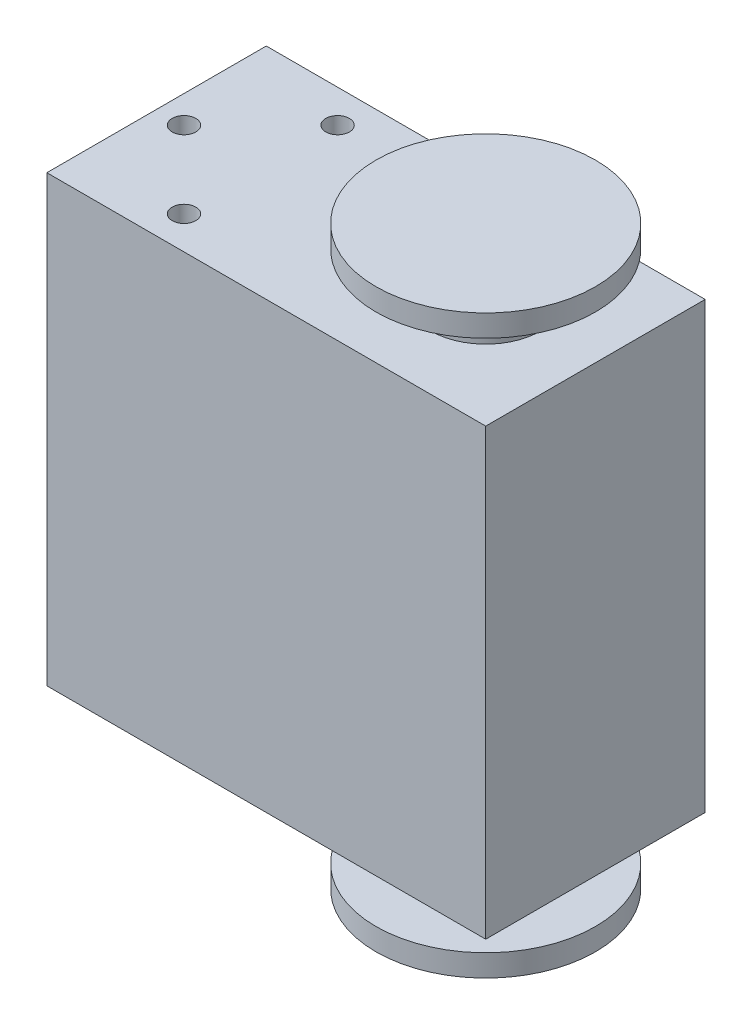
from build123d import *

# Parameters (mm, degrees)
SKETCH1_W                = 40
SKETCH1_H                = 40.5
BOSS_EXTRUDE1_DEPTH      = 20
BOSS_EXTRUDE2_DEPTH      = 6
BOSS_EXTRUDE2_DEPTH_BACK = 46.5
SKETCH2_R                = 10
SKETCH3_R                = 1
CUT_EXTRUDE1_DEPTH       = 5
SKETCH4_R                = 1.076171204
CUT_EXTRUDE2_DEPTH       = 5
SKETCH5_R                = 10
SKETCH5_R_2              = 5
CUT_EXTRUDE3_DEPTH       = 4


with BuildPart() as part:
    # Sketch1 → Boss-Extrude1 (new body)
    with BuildSketch(Plane.XY):
        with Locations((20, 20.25)):
            Rectangle(SKETCH1_W, SKETCH1_H)
    extrude(amount=BOSS_EXTRUDE1_DEPTH)

    # Sketch2 → Boss-Extrude2 (add, two sides: drawn at the far end of the back side and taken through both)
    with BuildSketch(Plane(origin=(0, 40.5, 0), x_dir=(1, 0, 0), z_dir=(0, 1, 0)).offset(-BOSS_EXTRUDE2_DEPTH_BACK)):
        with Locations(Location((30, -10, 0), (0, 0, 270))):
            Circle(SKETCH2_R)
    extrude(amount=BOSS_EXTRUDE2_DEPTH + BOSS_EXTRUDE2_DEPTH_BACK)

    # Sketch3 → Cut-Extrude1 (cut)
    with BuildSketch(Plane(origin=(0, 0, 0), x_dir=(-1, 0, 0), z_dir=(0, -1, 0))):
        with Locations(Location((-17.5, -2.5, 0), (0, 0, 90))):
            Circle(SKETCH3_R)
        with Locations(Location((-17.5, -17.5, 0), (0, 0, 90))):
            Circle(SKETCH3_R)
        with Locations(Location((-2.5, -17.5, 0), (0, 0, 90))):
            Circle(SKETCH3_R)
        with Locations(Location((-2.5, -2.5, 0), (0, 0, 90))):
            Circle(SKETCH3_R)
    extrude(amount=-CUT_EXTRUDE1_DEPTH, mode=Mode.SUBTRACT)

    # Sketch4 → Cut-Extrude2 (cut)
    with BuildSketch(Plane(origin=(0, 40.5, 0), x_dir=(1, 0, 0), z_dir=(0, 1, 0))):
        with Locations(Location((2.5, -10, 0), (0, 0, 270))):
            Circle(SKETCH4_R)
        with Locations(Location((9.5, -17, 0), (0, 0, 270))):
            Circle(SKETCH4_R)
        with Locations(Location((9.5, -3, 0), (0, 0, 270))):
            Circle(SKETCH4_R)
    extrude(amount=-CUT_EXTRUDE2_DEPTH, mode=Mode.SUBTRACT)

    # Sketch5 → Cut-Extrude3 (cut)
    with BuildSketch(Plane(origin=(0, 40.5, 0), x_dir=(1, 0, 0), z_dir=(0, 1, 0))):
        with Locations(Location((30, -10, 0), (0, 0, 270))):
            Circle(SKETCH5_R)
        with Locations(Location((30, -10, 0), (0, 0, 270))):
            Circle(SKETCH5_R_2, mode=Mode.SUBTRACT)
    cut_extrude3 = extrude(amount=CUT_EXTRUDE3_DEPTH, mode=Mode.SUBTRACT)

    # Mirror1: Cut-Extrude3 across plane
    add(cut_extrude3.mirror(Plane.ZX.offset(20.25)), mode=Mode.SUBTRACT)


solid = part.part
